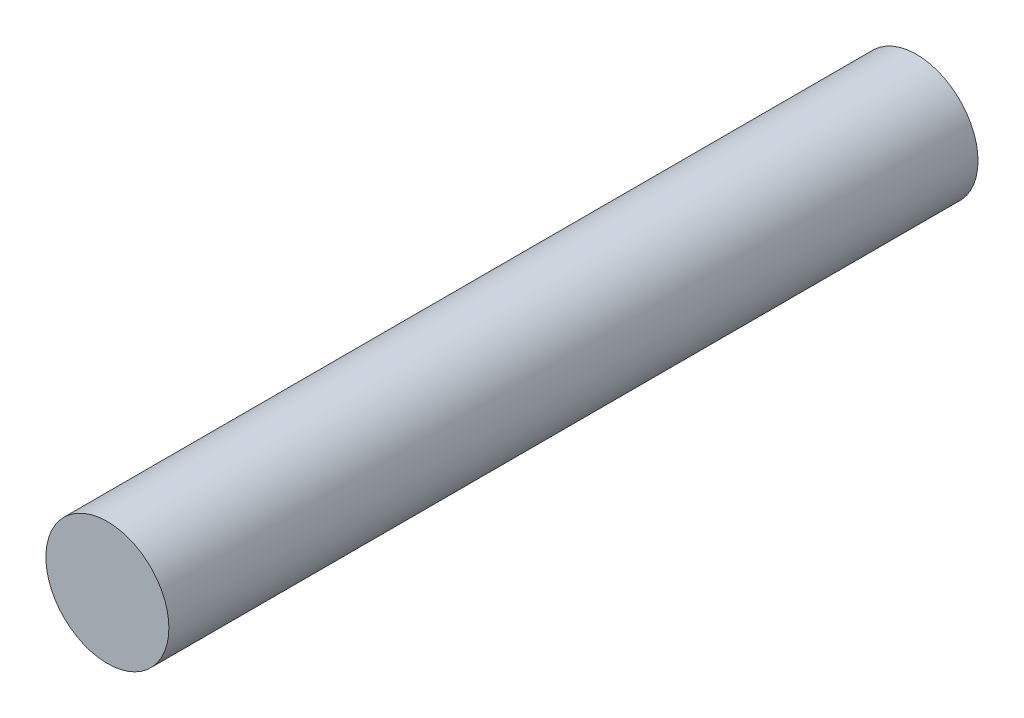
from build123d import *

# Parameters (mm, degrees)
SKETCH1_R           = 1.9
BOSS_EXTRUDE1_DEPTH = 12.5


with BuildPart() as part:
    # Sketch1 → Boss-Extrude1 (new, symmetric)
    with BuildSketch(Plane.XY):
        Circle(SKETCH1_R)
    extrude(amount=BOSS_EXTRUDE1_DEPTH, both=True)


solid = part.part
